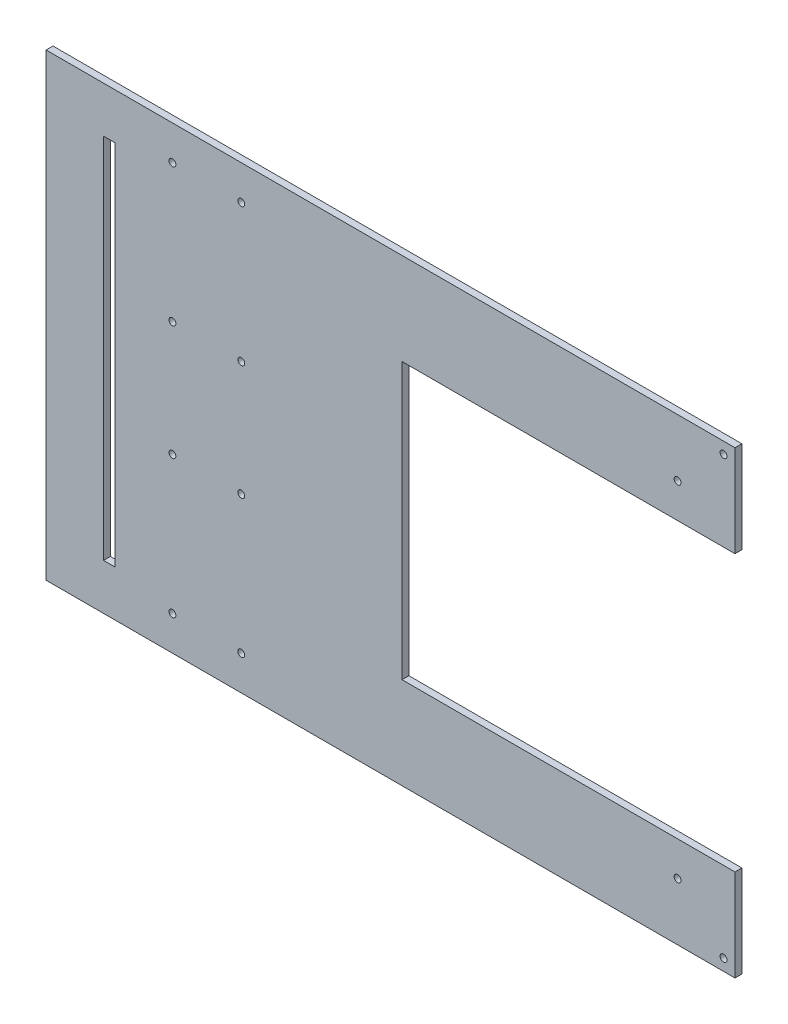
from build123d import *

# Parameters (mm, degrees)
SKETCH1_W             = 300
SKETCH1_H             = 200
BOSS_EXTRUDE1_DEPTH   = 3
SKETCH2_W             = 145
SKETCH2_H             = 120
CUT_EXTRUDE1_DEPTH    = 3
SKETCH3_W             = 5
SKETCH3_H             = 160
CUT_EXTRUDE2_DEPTH    = 3
F_3_0MM_DOWEL_HOLE1_D = 3


with BuildPart() as part:
    # Sketch1 → Boss-Extrude1 (new body)
    with BuildSketch(Plane.XY):
        with Locations((150, 100)):
            Rectangle(SKETCH1_W, SKETCH1_H)
    extrude(amount=BOSS_EXTRUDE1_DEPTH)

    # Sketch2 → Cut-Extrude1 (cut)
    with BuildSketch(Plane.XY):
        with Locations((227.5, 100)):
            Rectangle(SKETCH2_W, SKETCH2_H)
    extrude(amount=CUT_EXTRUDE1_DEPTH, mode=Mode.SUBTRACT)

    # Sketch3 → Cut-Extrude2 (cut)
    with BuildSketch(Plane.XY):
        with Locations((27.5, 100)):
            Rectangle(SKETCH3_W, SKETCH3_H)
    extrude(amount=CUT_EXTRUDE2_DEPTH, mode=Mode.SUBTRACT)

    # Ø3.0mm Dowel Hole1 (through all)
    with Locations(Plane(origin=(0, 0, 0), x_dir=(-1, 0, 0), z_dir=(0, 0, -1))):
        with Locations((-85, 75), (-55, 75), (-55, 15), (-85, 15), (-295, 5), (-275, 25), (-85, 185), (-55, 185), (-55, 125), (-85, 125), (-275, 175), (-295, 195)):
            Hole(F_3_0MM_DOWEL_HOLE1_D / 2)


solid = part.part
